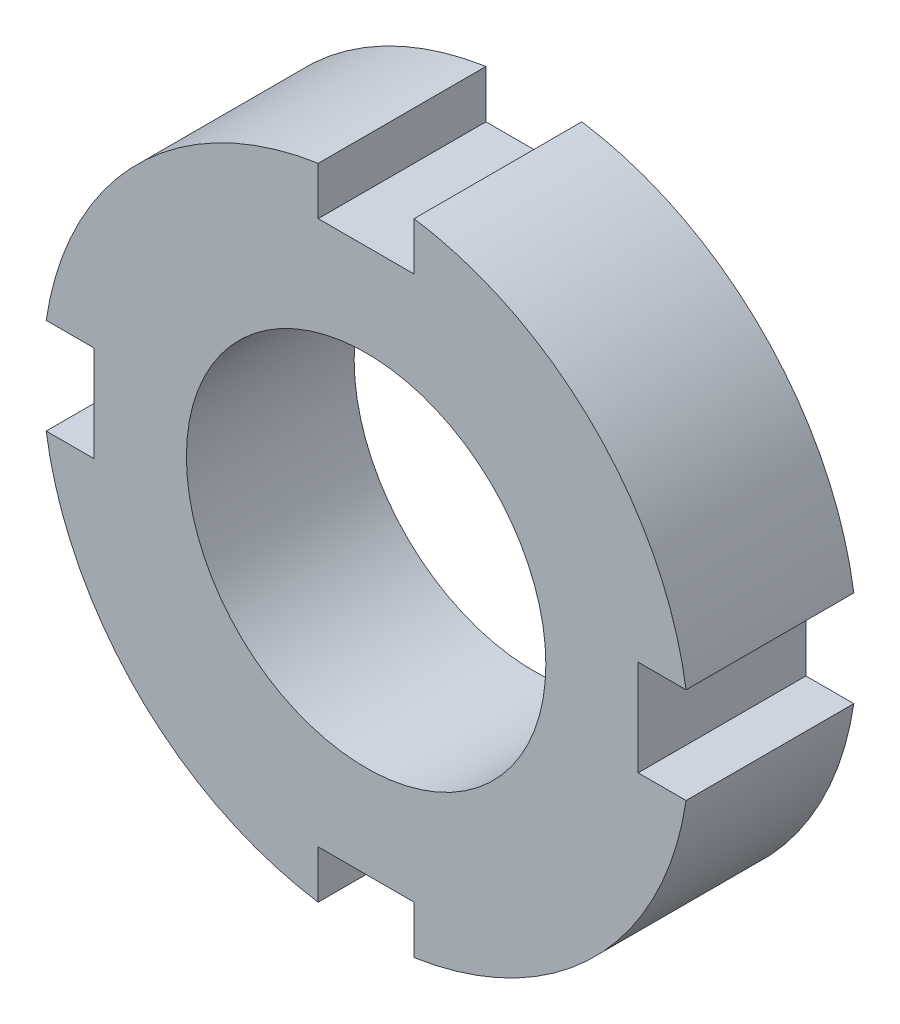
from build123d import *

# Parameters (mm, degrees)
ESBO_O1_R                = 7.5
RESSALTO_EXTRUS_O1_DEPTH = 7


with BuildPart() as part:
    # Esboço1 → Ressalto-extrusão1 (new body)
    with BuildSketch(Plane.XY):
        with BuildLine():
            Line((2, 11.351029923), (-2, 11.351029923))
            Line((-2, 11.351029923), (-2, 13.351029923))
            ThreePointArc((-2, 13.351029923), (-9.545941546, 9.545941546), (-13.351029923, 2))
            Line((-13.351029923, 2), (-11.351029923, 2))
            Line((-11.351029923, 2), (-11.351029923, -2))
            Line((-11.351029923, -2), (-13.351029923, -2))
            ThreePointArc((-13.351029923, -2), (-9.545941546, -9.545941546), (-2, -13.351029923))
            Line((-2, -13.351029923), (-2, -11.351029923))
            Line((-2, -11.351029923), (2, -11.351029923))
            Line((2, -11.351029923), (2, -13.351029923))
            ThreePointArc((2, -13.351029923), (9.545941546, -9.545941546), (13.351029923, -2))
            Line((13.351029923, -2), (11.351029923, -2))
            Line((11.351029923, -2), (11.351029923, 2))
            Line((11.351029923, 2), (13.351029923, 2))
            ThreePointArc((13.351029923, 2), (9.545941546, 9.545941546), (2, 13.351029923))
            Line((2, 13.351029923), (2, 11.351029923))
        make_face()
        Circle(ESBO_O1_R, mode=Mode.SUBTRACT)
    extrude(amount=RESSALTO_EXTRUS_O1_DEPTH)


solid = part.part
